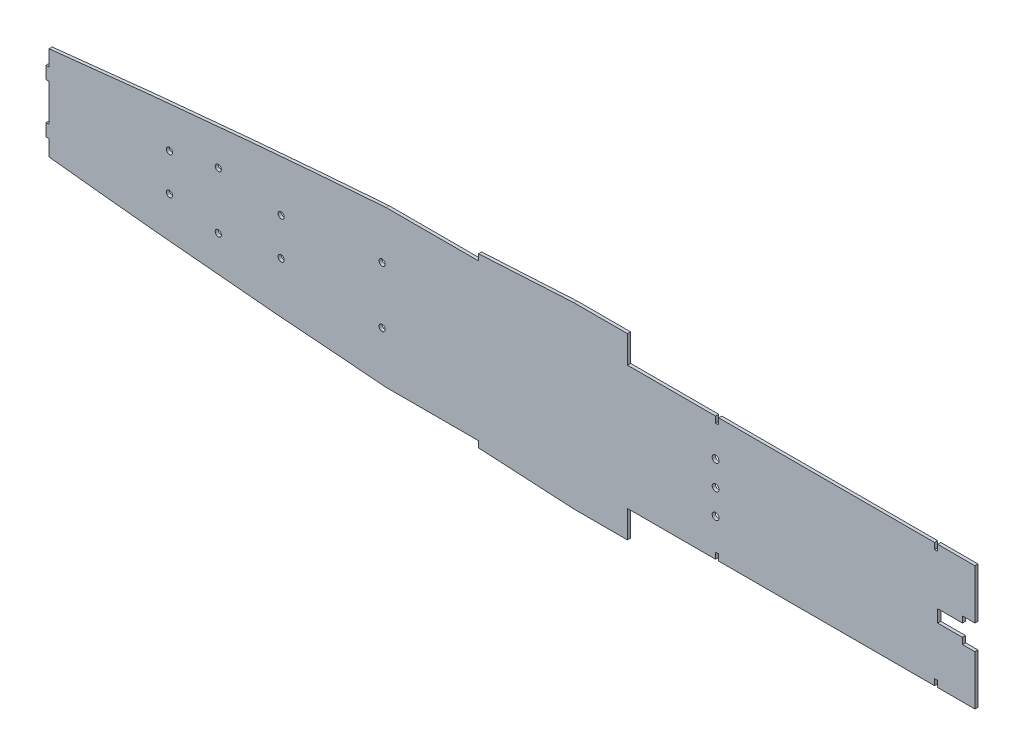
from build123d import *

# Parameters (mm, degrees)
BOSS_EXTRUDE1_DEPTH    = 1.5875
CUT_EXTRUDE1_DEPTH     = 637.645771754
SKETCH4_W              = 1.5875
SKETCH4_H              = 3.175
CUT_EXTRUDE2_DEPTH     = 637.645771754
SKETCH6_W              = 47.338109293
SKETCH6_H              = 3.175
CUT_EXTRUDE3_DEPTH     = 637.645771754
SKETCH7_R              = 1.5875
ARTS4_MOUNT_DEPTH      = 637.645771754
SKETCH8_R              = 1.5875
TELEMETRUM_MOUNT_DEPTH = 637.645771754
SKETCH9_R              = 1.74625
CUT_EXTRUDE4_DEPTH     = 637.645771754


with BuildPart() as part:
    # Sketch1 → Boss-Extrude1 (new body)
    with BuildSketch(Plane.XY):
        with BuildLine():
            Line((508, -45.72), (508, -34.29))
            Line((508, -34.29), (635, -34.29))
            Line((635, -34.29), (635, 34.29))
            Line((635, 34.29), (508, 34.29))
            Line((508, 34.29), (508, 45.72))
            Line((508, 45.72), (429.947642932, 45.72))
            add(Edge.make_bspline(
                [(161.29, 23.981640211), (161.616784041, 24.018741883), (172.383373415, 25.239568053), (204.048179593, 28.679227521), (256.348102033, 33.727983978), (319.188209115, 38.915614913), (371.60802888, 42.52482202), (408.536828327, 44.644949518), (424.488578703, 45.455997775), (429.947642932, 45.72)],
                knots=[0.31962734, 0.31962734, 0.31962734, 0.31962734, 0.321557959, 0.383234508, 0.506587607, 0.629940705, 0.753293803, 0.814970352, 0.847054623, 0.847054623, 0.847054623, 0.847054623], degree=3))
            Line((161.29, 23.981640211), (161.29, 15.875))
            Line((161.29, 15.875), (159.7025, 15.875))
            Line((159.7025, 15.875), (159.7025, 9.525))
            Line((159.7025, 9.525), (161.29, 9.525))
            Line((161.29, 9.525), (161.29, -9.525))
            Line((161.29, -9.525), (159.7025, -9.525))
            Line((159.7025, -9.525), (159.7025, -15.875))
            Line((159.7025, -15.875), (161.29, -15.875))
            Line((161.29, -15.875), (161.29, -23.981640211))
            add(Edge.make_bspline(
                [(429.947642932, -45.72), (424.488578703, -45.455997775), (408.536828327, -44.644949518), (371.60802888, -42.52482202), (319.188209115, -38.915614913), (256.348102033, -33.727983978), (204.048179593, -28.679227521), (172.383373415, -25.239568053), (161.616784041, -24.018741883), (161.29, -23.981640211)],
                knots=[0.16612059, 0.16612059, 0.16612059, 0.16612059, 0.198204861, 0.25988141, 0.383234508, 0.506587607, 0.629940705, 0.691617254, 0.693547873, 0.693547873, 0.693547873, 0.693547873], degree=3))
            Line((429.947642932, -45.72), (508, -45.72))
        make_face()
    extrude(amount=BOSS_EXTRUDE1_DEPTH)

    # Sketch3 → Cut-Extrude1 (cut, through all)
    with BuildSketch(Plane.XY.offset(1.5875)):
        Polygon((635, 34.29), (508, 34.29), (508, 45.72), (457.2, 45.72), (457.2, 31.75), (635, 31.75), align=None)
        Polygon((508, -45.72), (508, -34.29), (635, -34.29), (635, -31.75), (457.2, -31.75), (457.2, -45.72), align=None)
        Polygon((628.65, 6.35), (628.65, 3.175), (615.95, 3.175), (615.95, -3.175), (628.65, -3.175), (628.65, -6.35), (635, -6.35), (635, 6.35), align=None)
    extrude(amount=-CUT_EXTRUDE1_DEPTH, mode=Mode.SUBTRACT)

    # Sketch4 → Cut-Extrude2 (cut, through all)
    with BuildSketch(Plane.XY.offset(1.5875)):
        with Locations((503.1105, 30.1625)):
            Rectangle(SKETCH4_W, SKETCH4_H)
        with Locations((615.15625, 30.1625)):
            Rectangle(SKETCH4_W, SKETCH4_H)
        with Locations((503.1105, -30.1625)):
            Rectangle(SKETCH4_W, SKETCH4_H)
        with Locations((615.15625, -30.1625)):
            Rectangle(SKETCH4_W, SKETCH4_H)
    extrude(amount=-CUT_EXTRUDE2_DEPTH, mode=Mode.SUBTRACT)

    # Sketch6 → Cut-Extrude3 (cut, through all)
    with BuildSketch(Plane.XY.offset(1.5875)):
        with Locations((357.330945353, 41.432202354)):
            Rectangle(SKETCH6_W, SKETCH6_H)
        with Locations((357.330945353, -41.432202354)):
            Rectangle(SKETCH6_W, SKETCH6_H)
    extrude(amount=-CUT_EXTRUDE3_DEPTH, mode=Mode.SUBTRACT)

    # Sketch7 → ARTS4 mount (cut, through all)
    with BuildSketch(Plane.XY.offset(1.5875)):
        with Locations((331.688780886, 14.478)):
            Circle(SKETCH7_R)
        with Locations((331.688780886, -14.478)):
            Circle(SKETCH7_R)
        with Locations((247.868780886, 14.478)):
            Circle(SKETCH7_R)
        with Locations((247.868780886, -14.478)):
            Circle(SKETCH7_R)
    extrude(amount=-ARTS4_MOUNT_DEPTH, mode=Mode.SUBTRACT)

    # Sketch8 → Telemetrum Mount (cut, through all)
    with BuildSketch(Plane.XY.offset(1.5875)):
        with Locations((280.018433255, 9.525)):
            Circle(SKETCH8_R)
        with Locations((280.018433255, -9.525)):
            Circle(SKETCH8_R)
        with Locations((222.893833255, -9.525)):
            Circle(SKETCH8_R)
        with Locations((222.893833255, 9.525)):
            Circle(SKETCH8_R)
    extrude(amount=-TELEMETRUM_MOUNT_DEPTH, mode=Mode.SUBTRACT)

    # Sketch9 → Cut-Extrude4 (cut, through all)
    with BuildSketch(Plane.XY.offset(1.5875)):
        with Locations((502.31675, -12.7)):
            Circle(SKETCH9_R)
        with Locations((502.31675, 12.7)):
            Circle(SKETCH9_R)
        with Locations((502.31675, 0)):
            Circle(SKETCH9_R)
    extrude(amount=-CUT_EXTRUDE4_DEPTH, mode=Mode.SUBTRACT)


solid = part.part
